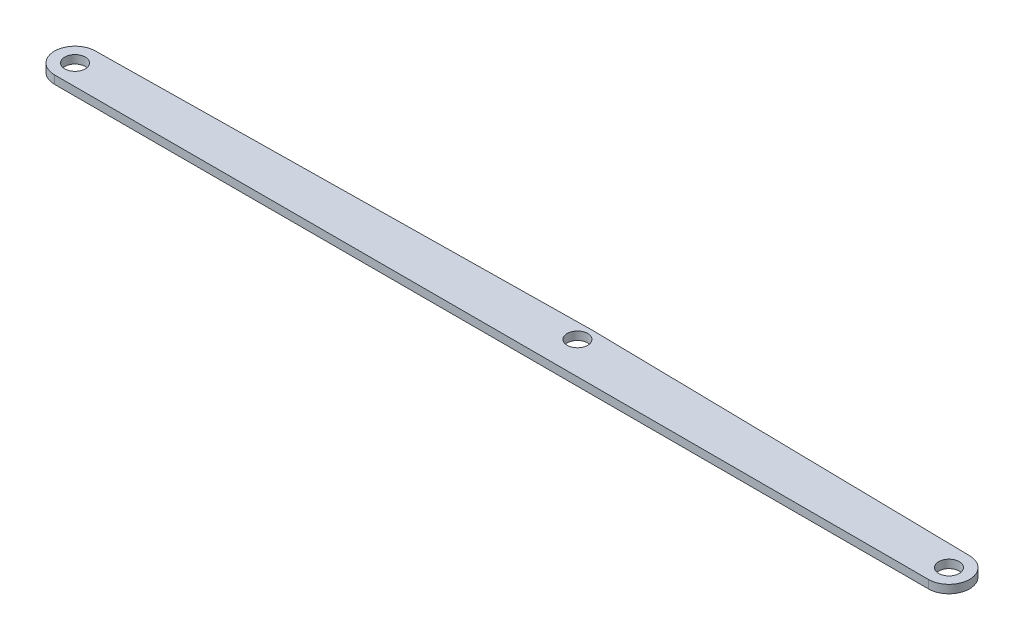
from build123d import *

# Parameters (mm, degrees)
SKETCH2_R           = 6.35
BOSS_EXTRUDE1_DEPTH = 5.08


with BuildPart() as part:
    # Sketch2 → Boss-Extrude1 (new body)
    with BuildSketch(Plane(origin=(0, 0, 0), x_dir=(1, 0, 0), z_dir=(0, 1, 0))):
        with BuildLine():
            Line((-539.8, -12.7), (0, -12.7))
            ThreePointArc((0, -12.7), (12.7, 0), (0, 12.7))
            Line((0, 12.7), (-236.622080232, 16.815883631))
            ThreePointArc((-236.622080232, 16.815883631), (-236.769626647, 16.817307044), (-236.917177407, 16.81644469))
            Line((-236.917177407, 16.81644469), (-539.8, 12.7))
            ThreePointArc((-539.8, 12.7), (-552.5, 0), (-539.8, -12.7))
        make_face()
        with Locations(Location((0, 0, 0), (0, 0, 270))):
            Circle(SKETCH2_R, mode=Mode.SUBTRACT)
        with Locations(Location((-539.8, 0, 0), (0, 0, 270))):
            Circle(SKETCH2_R, mode=Mode.SUBTRACT)
        with Locations(Location((-236.78773621, 7.29232426, 0), (0, 0, 270))):
            Circle(SKETCH2_R, mode=Mode.SUBTRACT)
    extrude(amount=BOSS_EXTRUDE1_DEPTH)


solid = part.part
